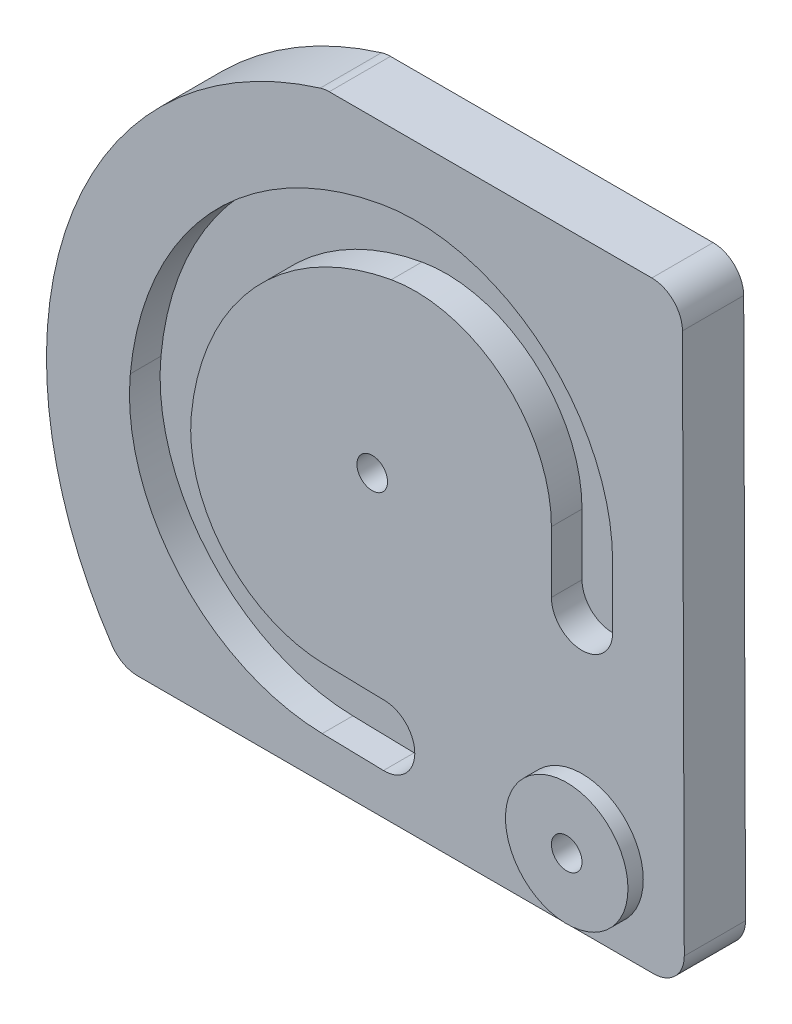
from build123d import *

# Parameters (mm, degrees)
BOSS_EXTRUDE1_DEPTH     = 10
BOSS_EXTRUDE2_START     = 10
BOSS_EXTRUDE2_DEPTH     = 10
SKETCH1_5_R             = 20
BOSS_EXTRUDE3_DEPTH     = 15
CUT_EXTRUDE1_DEPTH      = 215.297519294
CUT_EXTRUDE1_DEPTH_BACK = 215.297519294
SKETCH1_6_R             = 5


with BuildPart() as part:
    # Sketch1 → Boss-Extrude1 (new body)
    with BuildSketch(Plane.XY):
        with BuildLine():
            Line((-32.55466062, 173.476173045), (72.802083582, 173.476173045))
            ThreePointArc((72.802083582, 173.476173045), (79.861224101, 170.559148064), (82.802026774, 163.50988007))
            Line((82.802026774, 163.50988007), (83.39706002, -13.020047424))
            ThreePointArc((83.39706002, -13.020047424), (80.480091848, -20.112894968), (73.397116829, -23.053754449))
            Line((73.397116829, -23.053754449), (-95.173260832, -23.053754449))
            ThreePointArc((-95.173260832, -23.053754449), (-99.882498656, -21.875493456), (-103.481994233, -18.618370272))
            ThreePointArc((-103.481994233, -18.618370272), (-117.625312011, 94.28140669), (-35.49963159, 173.032696784))
            ThreePointArc((-35.49963159, 173.032696784), (-34.043748026, 173.364682472), (-32.55466062, 173.476173045))
        make_face()
    extrude(amount=-BOSS_EXTRUDE1_DEPTH)

    # Sketch1<3> → Boss-Extrude2 (add)
    with BuildSketch(Plane.XY.offset(BOSS_EXTRUDE2_START)):
        with BuildLine():
            Line((72.802083582, 173.476173045), (-32.55466062, 173.476173045))
            ThreePointArc((-32.55466062, 173.476173045), (-34.043748026, 173.364682472), (-35.49963159, 173.032696784))
            ThreePointArc((-35.49963159, 173.032696784), (-117.625312011, 94.28140669), (-103.481994233, -18.618370272))
            ThreePointArc((-103.481994233, -18.618370272), (-99.882498656, -21.875493456), (-95.173260832, -23.053754449))
            Line((-95.173260832, -23.053754449), (73.397116829, -23.053754449))
            ThreePointArc((73.397116829, -23.053754449), (80.480091848, -20.112894968), (83.39706002, -13.020047424))
            Line((83.39706002, -13.020047424), (82.802026774, 163.50988007))
            ThreePointArc((82.802026774, 163.50988007), (79.861224101, 170.559148064), (72.802083582, 173.476173045))
        make_face()
        with BuildLine():
            ThreePointArc((-14.394574448, 10.329008016), (-4.623864336, 0.104858961), (-14.848013391, -9.665851152))
            Line((-14.848013391, -9.665851152), (-34.848013391, -9.212295627))
            ThreePointArc((-34.848013391, -9.212295627), (-81.502346372, 12.352630755), (-97.534327335, 61.185492868))
            ThreePointArc((-97.534327335, 61.185492868), (-71.659502341, 119.425599438), (-15.814833806, 150.130478169))
            ThreePointArc((-15.814833806, 150.130478169), (36.907828278, 136.13803225), (59.999999943, 86.719217535))
            Line((59.999999943, 86.719217535), (59.999999943, 66.719217535))
            ThreePointArc((59.999999943, 66.719217535), (49.999999943, 56.719217535), (39.999999943, 66.719217535))
            Line((39.999999943, 66.719217535), (39.999999943, 86.719217535))
            ThreePointArc((39.999999943, 86.719217535), (24.076427728, 120.796742868), (-12.279317814, 130.445455266))
            ThreePointArc((-12.279317814, 130.445455266), (-56.931818797, 105.894326865), (-77.620913723, 59.326472063))
            ThreePointArc((-77.620913723, 59.326472063), (-66.565807676, 25.652999614), (-34.394574448, 10.78256354))
            Line((-34.394574448, 10.78256354), (-14.394574448, 10.329008016))
        make_face(mode=Mode.SUBTRACT)
    extrude(amount=-BOSS_EXTRUDE2_DEPTH)

    # Sketch1<5> → Boss-Extrude3 (add)
    with BuildSketch(Plane.XY):
        with Locations((50, 1.860098346)):
            Circle(SKETCH1_5_R)
    extrude(amount=BOSS_EXTRUDE3_DEPTH)

    # Sketch1<6> → Cut-Extrude1 (cut, two sides: drawn at the far end of the back side and taken through both)
    with BuildSketch(Plane.XY.offset(-CUT_EXTRUDE1_DEPTH_BACK)):
        with Locations((-18.514628019, 72.64435198)):
            Circle(SKETCH1_6_R)
        with Locations((50, 1.860098346)):
            Circle(SKETCH1_6_R)
    extrude(amount=CUT_EXTRUDE1_DEPTH + CUT_EXTRUDE1_DEPTH_BACK, mode=Mode.SUBTRACT)


solid = part.part
